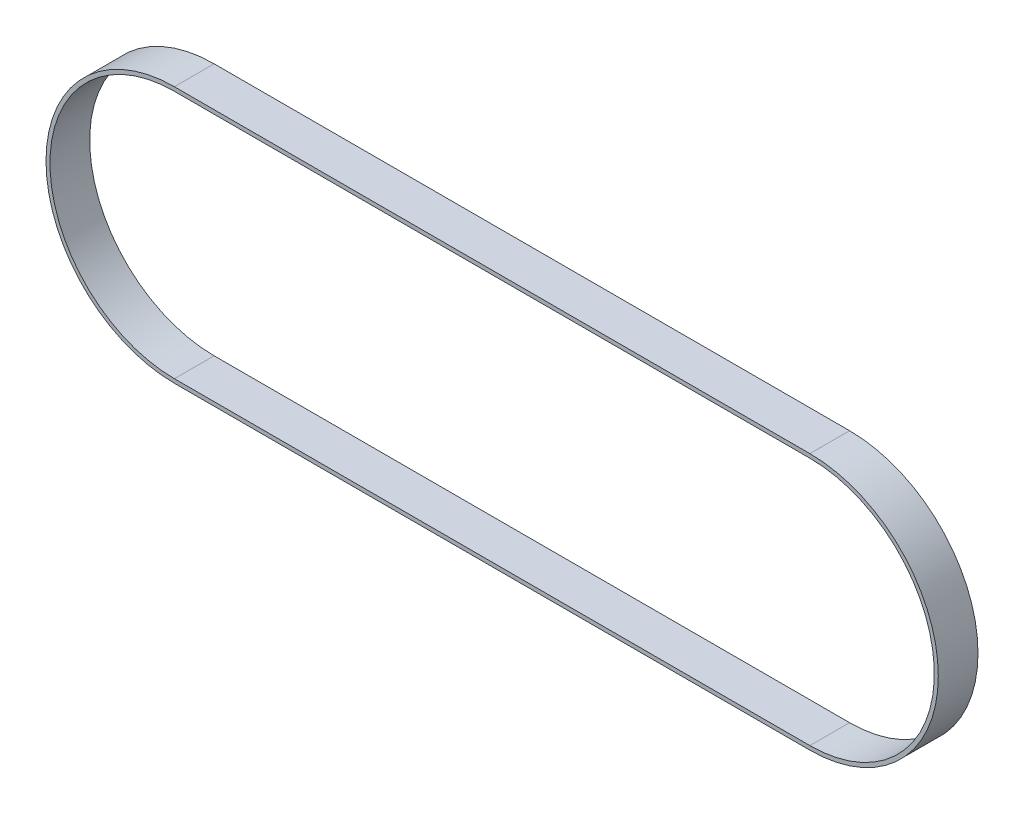
from build123d import *

# Parameters (mm, degrees)
BOSS_EXTRUDE1_DEPTH = 3


with BuildPart() as part:
    # Sketch1 → Boss-Extrude1 (new, symmetric)
    with BuildSketch(Plane.XY):
        with BuildLine():
            Line((0, -19.4), (96, -19.4))
            ThreePointArc((96, -19.4), (115.4, 0), (96, 19.4))
            Line((96, 19.4), (0, 19.4))
            ThreePointArc((0, 19.4), (-19.4, 0), (0, -19.4))
        make_face()
        with BuildLine():
            Line((0, 18.8), (96, 18.8))
            ThreePointArc((96, 18.8), (114.8, 0), (96, -18.8))
            Line((96, -18.8), (0, -18.8))
            ThreePointArc((0, -18.8), (-18.8, 0), (0, 18.8))
        make_face(mode=Mode.SUBTRACT)
    extrude(amount=BOSS_EXTRUDE1_DEPTH, both=True)


solid = part.part
